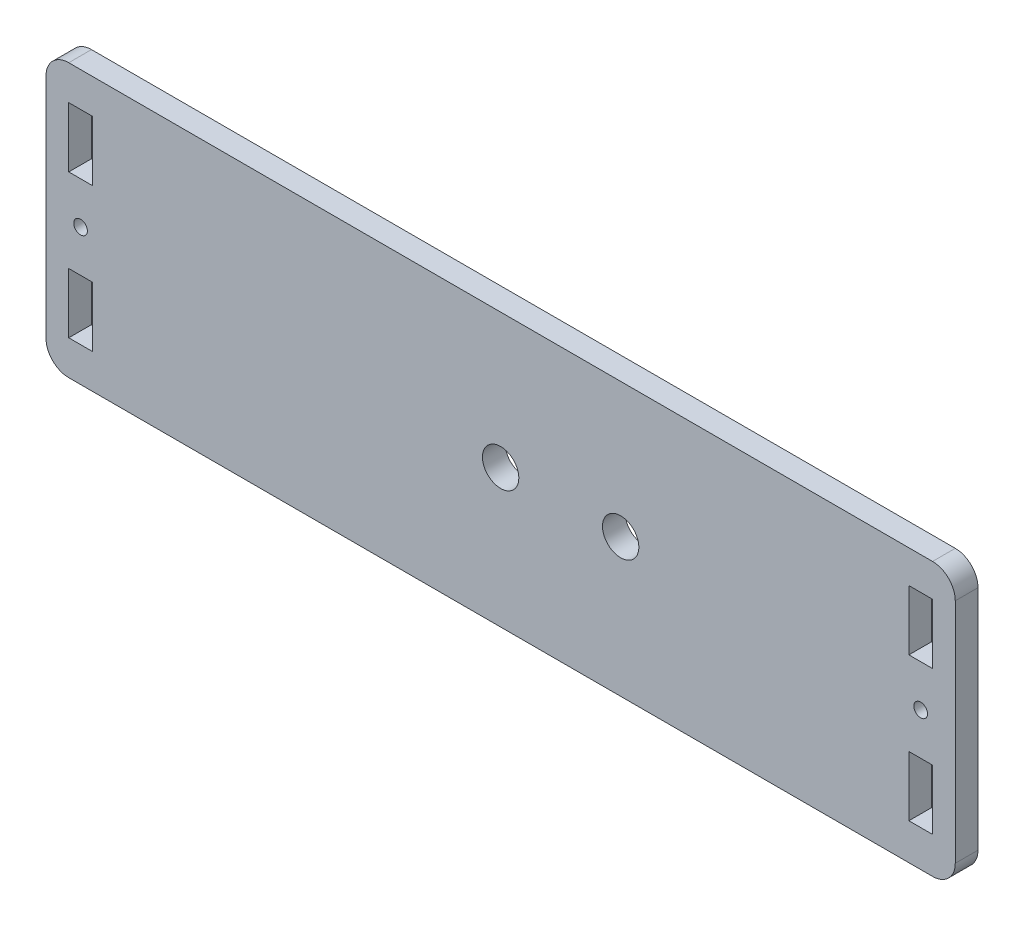
from build123d import *

# Parameters (mm, degrees)
SKETCH1_R           = 1.5
SKETCH1_R_2         = 4
SKETCH1_W           = 5.2
SKETCH1_H           = 13.2
BOSS_EXTRUDE1_DEPTH = 5


with BuildPart() as part:
    # Sketch1 → Boss-Extrude1 (new body)
    with BuildSketch(Plane.XY):
        with BuildLine():
            Line((-139.3729909, 139.350971349), (50.6270091, 139.350971349))
            ThreePointArc((50.6270091, 139.350971349), (54.162543006, 137.886505255), (55.6270091, 134.350971349))
            Line((55.6270091, 134.350971349), (55.6270091, 84.350971349))
            ThreePointArc((55.6270091, 84.350971349), (54.162543006, 80.815437443), (50.6270091, 79.350971349))
            Line((50.6270091, 79.350971349), (-139.3729909, 79.350971349))
            ThreePointArc((-139.3729909, 79.350971349), (-142.908524806, 80.815437443), (-144.3729909, 84.350971349))
            Line((-144.3729909, 84.350971349), (-144.3729909, 134.350971349))
            ThreePointArc((-144.3729909, 134.350971349), (-142.908524806, 137.886505255), (-139.3729909, 139.350971349))
        make_face()
        with Locations((48.024043129, 109.750971349)):
            Circle(SKETCH1_R, mode=Mode.SUBTRACT)
        with Locations(Location((-136.770024929, 109.350971349, 0), (0, 0, 180))):
            Circle(SKETCH1_R, mode=Mode.SUBTRACT)
        with Locations((-44.3729909, 109.750971349)):
            Circle(SKETCH1_R_2, mode=Mode.SUBTRACT)
        with Locations((-17.9729909, 109.750971349)):
            Circle(SKETCH1_R_2, mode=Mode.SUBTRACT)
        with Locations((-136.770024929, 125.150971349)):
            Rectangle(SKETCH1_W, SKETCH1_H, mode=Mode.SUBTRACT)
        with Locations((48.024043129, 93.950971349)):
            Rectangle(SKETCH1_W, SKETCH1_H, mode=Mode.SUBTRACT)
        with Locations((48.024043129, 125.550971349)):
            Rectangle(SKETCH1_W, SKETCH1_H, mode=Mode.SUBTRACT)
        with Locations((-136.770024929, 93.550971349)):
            Rectangle(SKETCH1_W, SKETCH1_H, mode=Mode.SUBTRACT)
    extrude(amount=BOSS_EXTRUDE1_DEPTH)


solid = part.part
